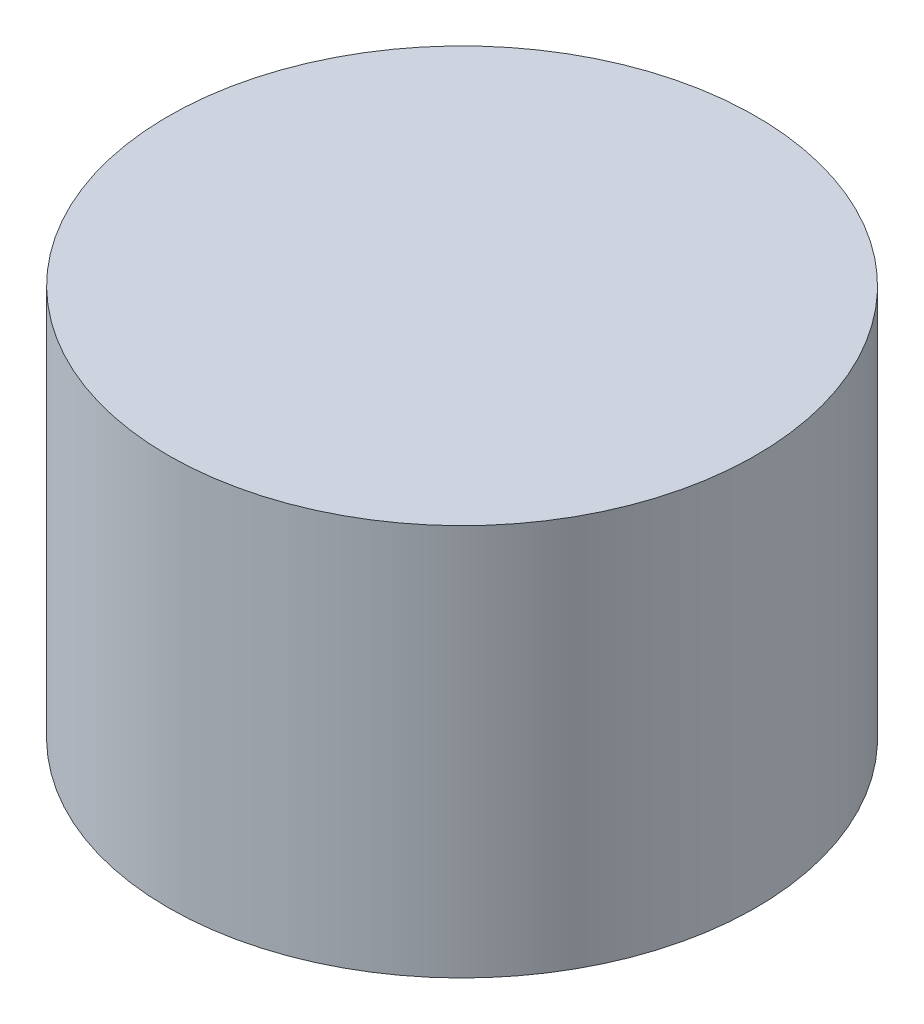
from build123d import *

# Parameters (mm, degrees)
SKETCH1_R           = 24
BOSS_EXTRUDE1_DEPTH = 32


with BuildPart() as part:
    # Sketch1 → Boss-Extrude1 (new body)
    with BuildSketch(Plane(origin=(0, 0, 0), x_dir=(1, 0, 0), z_dir=(0, 1, 0))):
        with Locations(Location((0, 0, 0), (0, 0, 270))):
            Circle(SKETCH1_R)
    extrude(amount=BOSS_EXTRUDE1_DEPTH)


solid = part.part
